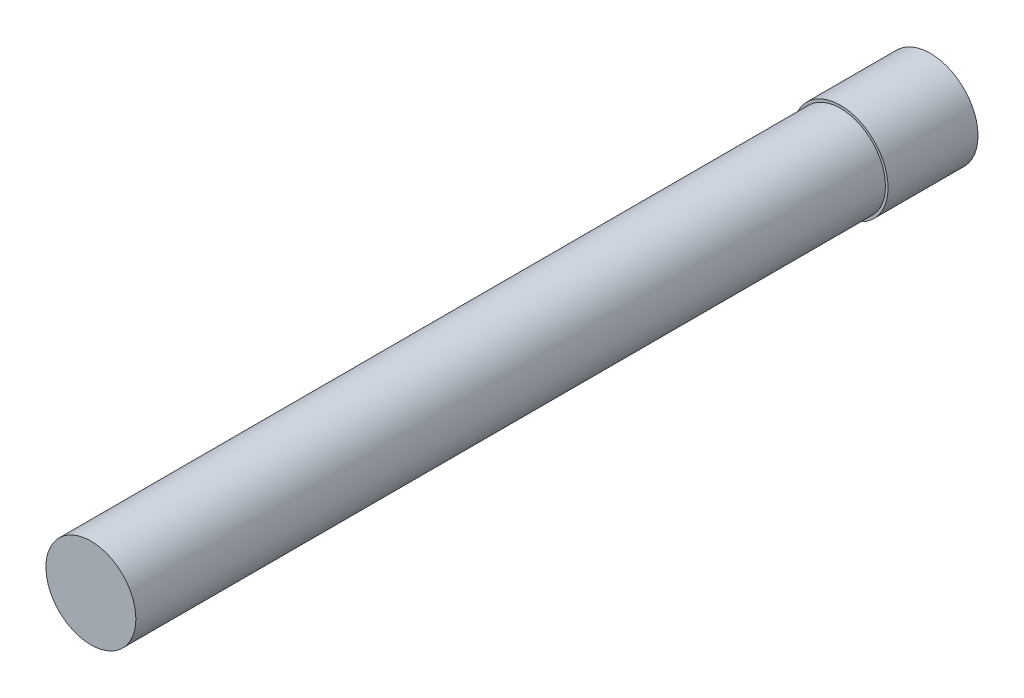
from build123d import *

# Parameters (mm, degrees)
SKETCH1_R           = 3.175
BOSS_EXTRUDE1_DEPTH = 6
SKETCH2_R           = 3
BOSS_EXTRUDE2_DEPTH = 50


with BuildPart() as part:
    # Sketch1 → Boss-Extrude1 (new body)
    with BuildSketch(Plane(origin=(0, 0, 0), x_dir=(0, 1, 0), z_dir=(0, 0, 1))):
        with Locations(Location((0, 0, 0), (0, 0, 270))):
            Circle(SKETCH1_R)
    extrude(amount=BOSS_EXTRUDE1_DEPTH)

    # Sketch2 → Boss-Extrude2 (add)
    with BuildSketch(Plane.XY.offset(6)):
        Circle(SKETCH2_R)
    extrude(amount=BOSS_EXTRUDE2_DEPTH)


solid = part.part
